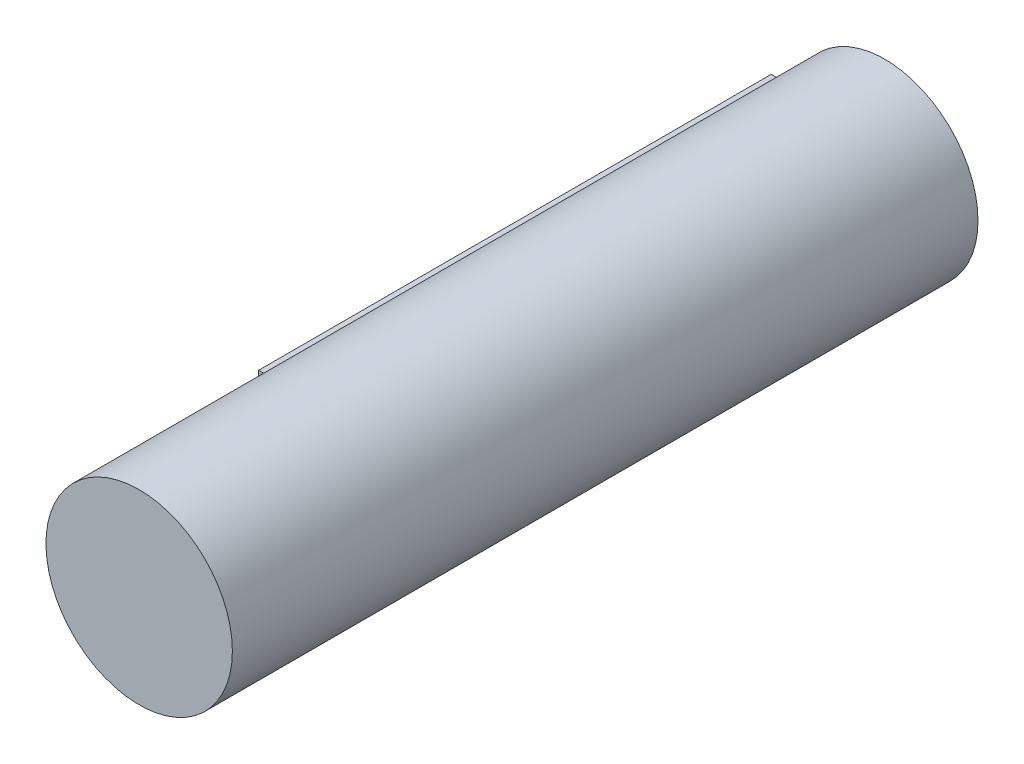
from build123d import *

# Parameters (mm, degrees)
SKETCH1_R           = 20
BOSS_EXTRUDE1_DEPTH = 160
BOSS_EXTRUDE2_DEPTH = 110


with BuildPart() as part:
    # Sketch1 → Boss-Extrude1 (new body)
    with BuildSketch(Plane.XY):
        Circle(SKETCH1_R)
    extrude(amount=BOSS_EXTRUDE1_DEPTH)

    # Sketch1<3> → Boss-Extrude2 (add)
    with BuildSketch(Plane.XY):
        with BuildLine():
            Line((-24.364916731, 5), (-24.364916731, -5))
            Line((-24.364916731, -5), (-19.364916731, -5))
            ThreePointArc((-19.364916731, -5), (-20, 0), (-19.364916731, 5))
            Line((-19.364916731, 5), (-24.364916731, 5))
        make_face()
    extrude(amount=BOSS_EXTRUDE2_DEPTH)


solid = part.part
